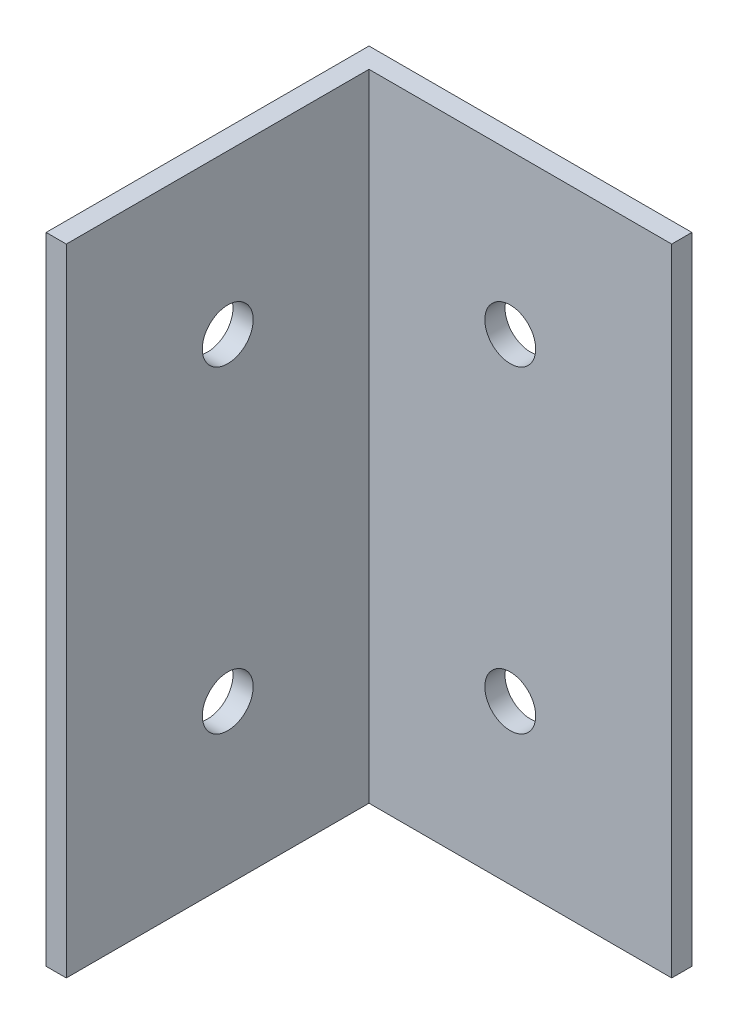
from build123d import *

# Parameters (mm, degrees)
BOSS_EXTRUDE1_DEPTH = 100
CUT_EXTRUDE1_REACH  = 125.131
SKETCH2_R           = 4


with BuildPart() as part:
    # Sketch1 → Boss-Extrude1 (new body)
    with BuildSketch(Plane(origin=(0, 0, 0), x_dir=(1, 0, 0), z_dir=(0, 1, 0))):
        Polygon((0, 0), (0, -50.8), (3.175, -50.8), (3.175, -3.175), (50.8, -3.175), (50.8, 0), align=None)
    extrude(amount=BOSS_EXTRUDE1_DEPTH)

    # Sketch2 → Cut-Extrude1 (cut, up to next)
    with BuildSketch(Plane(origin=(0, 0, 0), x_dir=(-1, 0, 0), z_dir=(0, 0, -1)), mode=Mode.PRIVATE) as cut_extrude1_sk1:
        with Locations((-25.4, 75)):
            Circle(SKETCH2_R)
    cut_extrude1_tool1 = extrude(cut_extrude1_sk1.sketch, amount=-CUT_EXTRUDE1_REACH, mode=Mode.PRIVATE) & part.part
    # Sketch2 → Cut-Extrude1 (cut, up to next)
    with BuildSketch(Plane(origin=(0, 0, 0), x_dir=(-1, 0, 0), z_dir=(0, 0, -1)), mode=Mode.PRIVATE) as cut_extrude1_sk2:
        with Locations((-25.4, 25)):
            Circle(SKETCH2_R)
    cut_extrude1_tool2 = extrude(cut_extrude1_sk2.sketch, amount=-CUT_EXTRUDE1_REACH, mode=Mode.PRIVATE) & part.part
    cut_extrude1_1 = cut_extrude1_tool1.solids().sort_by_distance((25.4, 75, 0))[0]
    add(cut_extrude1_1, mode=Mode.SUBTRACT)
    cut_extrude1_2 = cut_extrude1_tool2.solids().sort_by_distance((25.4, 25, 0))[0]
    add(cut_extrude1_2, mode=Mode.SUBTRACT)
    cut_extrude1 = cut_extrude1_1 + cut_extrude1_2  # Cut-Extrude1 as one shape, for the pattern or mirror that repeats it

    # Mirror1: Cut-Extrude1 across plane
    add(cut_extrude1.mirror(Plane(origin=(0, 0, 0), x_dir=(0.7071067811865478, 0, 0.7071067811865472), z_dir=(0.7071067811865475, 0, -0.7071067811865477))), mode=Mode.SUBTRACT)


solid = part.part
